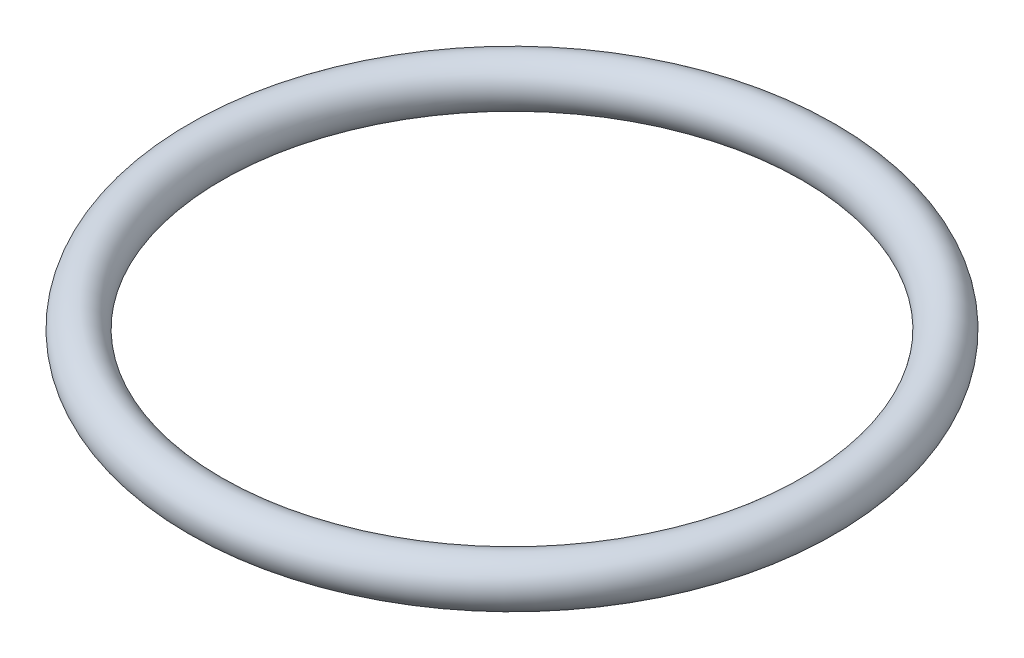
from build123d import *

# Parameters (mm, degrees)
SKETCH_1_R = 1.775


with BuildPart() as part:
    # 草图1 → 旋转1 (revolve)
    with BuildSketch(Plane.XY, mode=Mode.PRIVATE) as revolve_1_sk:
        with Locations((23.625, 0)):
            Circle(SKETCH_1_R)
    revolve(revolve_1_sk.sketch.rotate(Axis((0, 0, 0), (0, 1, 0)), 90), axis=Axis((0, 0, 0), (0, 1, 0)))


solid = part.part
